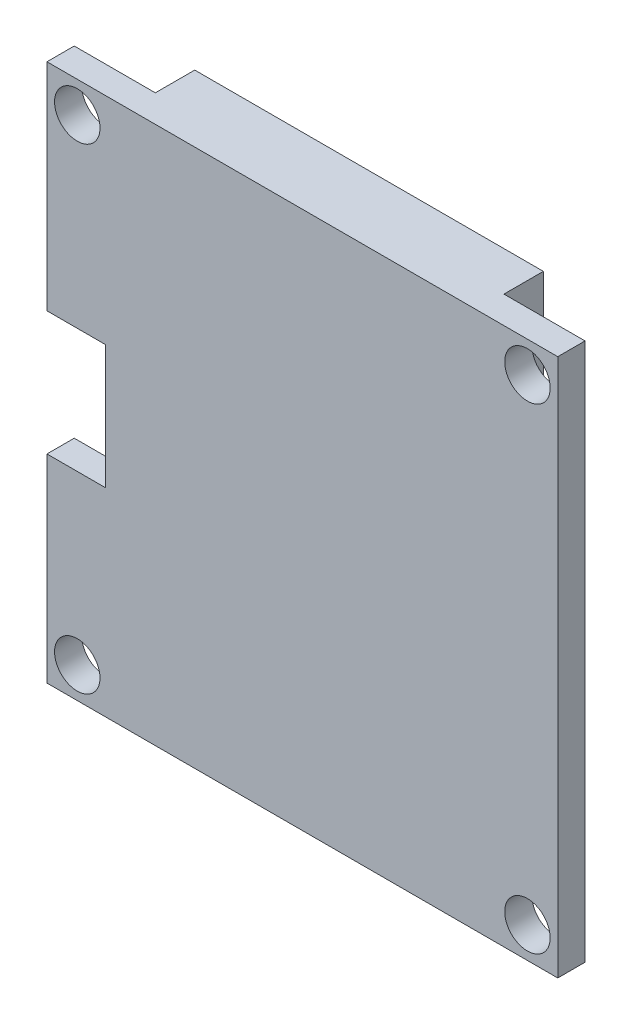
from build123d import *

# Parameters (mm, degrees)
SKETCH1_W           = 14.7
SKETCH1_H           = 29.42
SKETCH1_R           = 1.5
SKETCH1_W_2         = 23
SKETCH1_H_2         = 35.5
BOSS_EXTRUDE5_DEPTH = 1.8
SKETCH2_W           = 23
SKETCH2_H           = 35.5
BOSS_EXTRUDE7_DEPTH = 2.6
SKETCH3_R           = 0.510447256
SKETCH3_R_2         = 0.580916902
SKETCH3_R_3         = 0.525090018
CUT_EXTRUDE1_DEPTH  = 1
SKETCH5_R           = 0.520017215
CUT_EXTRUDE5_DEPTH  = 1


with BuildPart() as part:
    # Sketch1 → Boss-Extrude5 (new body)
    # profile 1 of 3: a face of its own
    with BuildSketch(Plane.XY):
        Rectangle(SKETCH1_W, SKETCH1_H)
    # profile 2 of 3: a face of its own
    with BuildSketch(Plane.XY):
        Polygon((16.85, 17.75), (-16.85, 17.75), (-16.85, 3.519072364), (-12.987679058, 3.519072364), (-12.987679058, -4.65716191), (-16.85, -4.65716191), (-16.85, -17.75), (16.85, -17.75), align=None)
        with Locations((14.85, -15.71)):
            Circle(SKETCH1_R, mode=Mode.SUBTRACT)
        with Locations((14.85, 15.71)):
            Circle(SKETCH1_R, mode=Mode.SUBTRACT)
        with Locations((-14.85, 15.71)):
            Circle(SKETCH1_R, mode=Mode.SUBTRACT)
        with Locations((-14.85, -15.71)):
            Circle(SKETCH1_R, mode=Mode.SUBTRACT)
    # profile 3 of 3: a face of its own
    with BuildSketch(Plane.XY):
        Rectangle(SKETCH1_W_2, SKETCH1_H_2)
    extrude(amount=BOSS_EXTRUDE5_DEPTH)

    # Sketch2 → Boss-Extrude7 (add)
    with BuildSketch(Plane(origin=(0, 0, 0), x_dir=(-1, 0, 0), z_dir=(0, 0, -1))):
        Rectangle(SKETCH2_W, SKETCH2_H)
    extrude(amount=BOSS_EXTRUDE7_DEPTH)

    # Sketch3 → Cut-Extrude1 (cut)
    with BuildSketch(Plane(origin=(0, 0, 0), x_dir=(-1, 0, 0), z_dir=(0, 0, -1))):
        with Locations((-14.722097133, -5.610781363)):
            Circle(SKETCH3_R)
        with Locations((-14.722097133, -1.550914358)):
            Circle(SKETCH3_R_2)
        with Locations((-14.741724546, 2.500014567)):
            Circle(SKETCH3_R_3)
    extrude(amount=-CUT_EXTRUDE1_DEPTH, mode=Mode.SUBTRACT)

    # Sketch5 → Cut-Extrude5 (cut)
    with BuildSketch(Plane(origin=(0, 0, 0), x_dir=(-1, 0, 0), z_dir=(0, 0, -1))):
        with Locations((-14.677272087, 5.717301692)):
            Circle(SKETCH5_R)
    extrude(amount=-CUT_EXTRUDE5_DEPTH, mode=Mode.SUBTRACT)


solid = part.part
